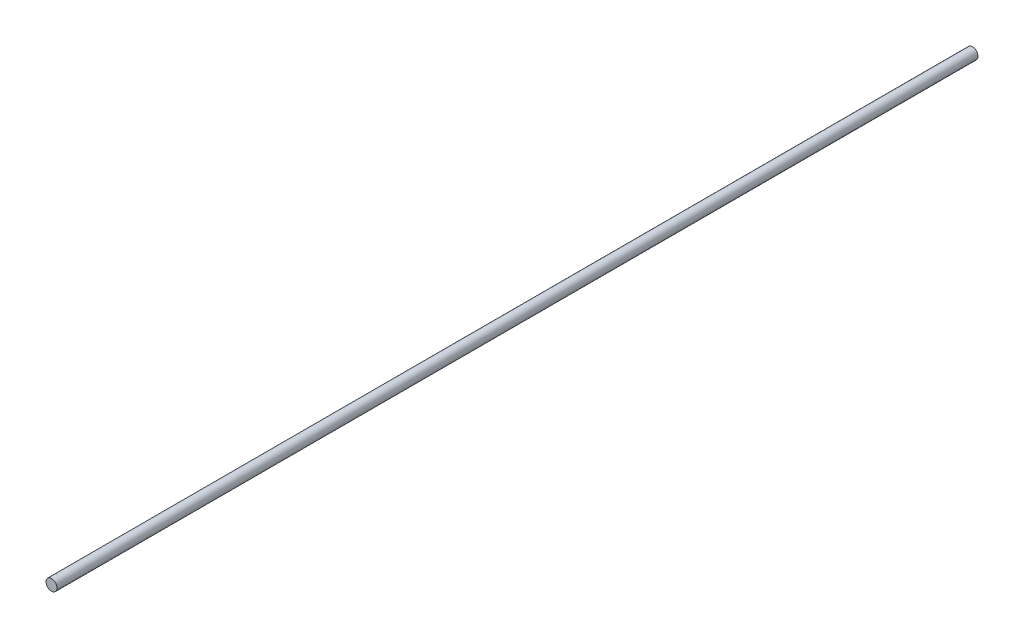
from build123d import *

# Parameters (mm, degrees)
SKETCH1_R           = 1.2
BOSS_EXTRUDE1_DEPTH = 200


with BuildPart() as part:
    # Sketch1 → Boss-Extrude1 (new body)
    with BuildSketch(Plane.XY):
        Circle(SKETCH1_R)
    extrude(amount=BOSS_EXTRUDE1_DEPTH)


solid = part.part
